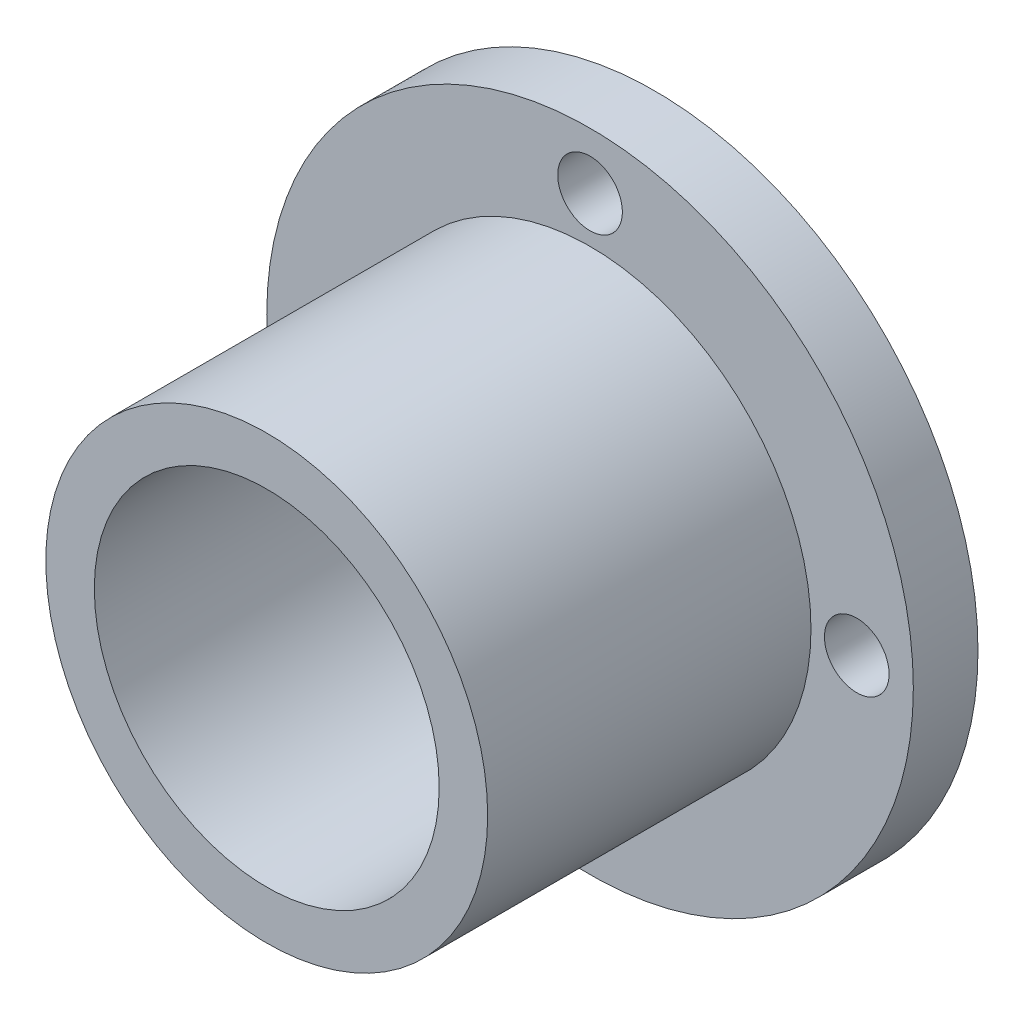
from build123d import *

# Parameters (mm, degrees)
SKETCH1_R           = 13.668
SKETCH1_R_2         = 10.668
BOSS_EXTRUDE1_DEPTH = 20
SKETCH2_R           = 20
BOSS_EXTRUDE2_DEPTH = 4
SKETCH3_R           = 2
M4_DRILL_DEPTH      = 4


with BuildPart() as part:
    # Sketch1 → Boss-Extrude1 (new body)
    with BuildSketch(Plane.XY):
        Circle(SKETCH1_R)
        Circle(SKETCH1_R_2, mode=Mode.SUBTRACT)
    extrude(amount=BOSS_EXTRUDE1_DEPTH)

    # Sketch2 → Boss-Extrude2 (add)
    with BuildSketch(Plane(origin=(0, 0, 0), x_dir=(-1, 0, 0), z_dir=(0, 0, -1))):
        Circle(SKETCH2_R)
    extrude(amount=BOSS_EXTRUDE2_DEPTH)

    # Sketch3 → M4_DRILL (cut)
    with BuildSketch(Plane.XY):
        with Locations((0, 16.5)):
            Circle(SKETCH3_R)
        with Locations((16.5, 0)):
            Circle(SKETCH3_R)
        with Locations((0, -16.5)):
            Circle(SKETCH3_R)
        with Locations((-16.5, 0)):
            Circle(SKETCH3_R)
    extrude(amount=-M4_DRILL_DEPTH, mode=Mode.SUBTRACT)


solid = part.part
